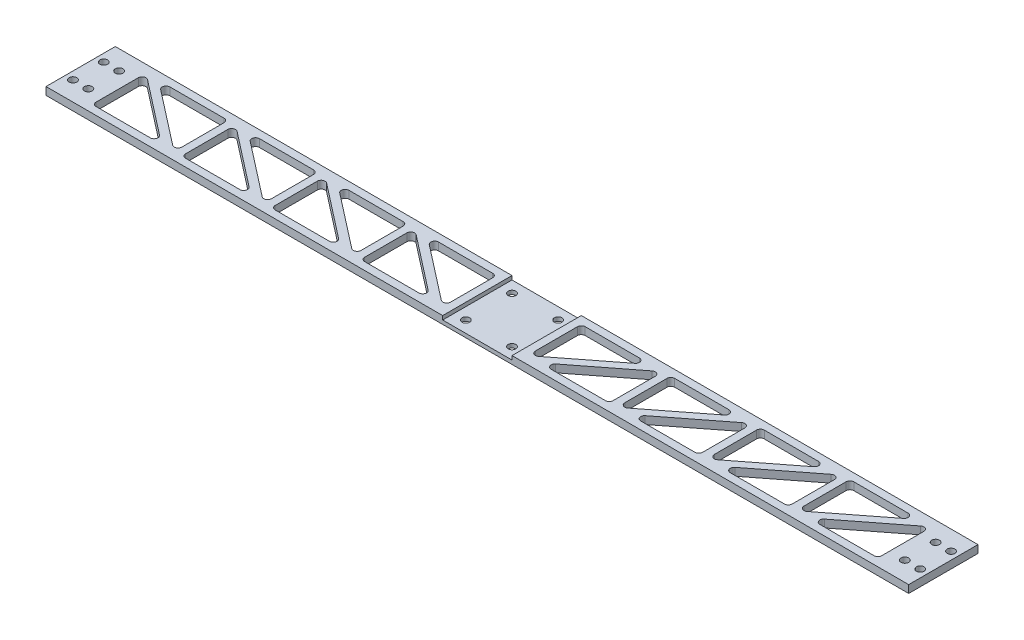
from build123d import *

# Parameters (mm, degrees)
SKETCH2_W                   = 57.15
SKETCH2_H                   = 6.35
BOSS_EXTRUDE2_DEPTH         = 355.6
F_1_4_0_25_DIAMETER_HOLE1_D = 6.35
CUT_EXTRUDE1_REACH          = 358.803
FILLET1_R                   = 3.175
FILLET1_OF_MIRROR1_R        = 3.175
SKETCH7_W                   = 57.15
SKETCH7_H                   = 57.15
CUT_EXTRUDE2_DEPTH          = 3.175
F_1_4_0_25_DIAMETER_HOLE2_D = 6.35


with BuildPart() as part:
    # Sketch2 → Boss-Extrude2 (new, symmetric)
    with BuildSketch(Plane(origin=(0, 0, 0), x_dir=(0, 0, -1), z_dir=(1, 0, 0))):
        Rectangle(SKETCH2_W, SKETCH2_H)
    extrude(amount=BOSS_EXTRUDE2_DEPTH, both=True)

    # 1/4 (0.25) Diameter Hole1 (through all)
    with Locations(Plane(origin=(0, 3.175, 0), x_dir=(1, 0, 0), z_dir=(0, 1, 0))):
        with Locations((-349.25, -12.7), (-349.25, 12.7), (-336.55, 12.7), (-336.55, -12.7)):
            f_1_4_0_25_diameter_hole1 = Hole(F_1_4_0_25_DIAMETER_HOLE1_D / 2)

    # Sketch6 → Cut-Extrude1 (cut, up to next)
    with BuildSketch(Plane(origin=(0, 3.175, 0), x_dir=(1, 0, 0), z_dir=(0, 1, 0)), mode=Mode.PRIVATE) as cut_extrude1_sk1:
        Polygon((-323.85, 22.225), (-323.85, -22.225), (-266.721810637, -22.225), align=None)
    cut_extrude1_tool1 = extrude(cut_extrude1_sk1.sketch, amount=-CUT_EXTRUDE1_REACH, mode=Mode.PRIVATE) & part.part
    # Sketch6 → Cut-Extrude1 (cut, up to next)
    with BuildSketch(Plane(origin=(0, 3.175, 0), x_dir=(1, 0, 0), z_dir=(0, 1, 0)), mode=Mode.PRIVATE) as cut_extrude1_sk2:
        Polygon((-313.509439363, 22.225), (-256.38125, -22.225), (-256.38125, 22.225), align=None)
    cut_extrude1_tool2 = extrude(cut_extrude1_sk2.sketch, amount=-CUT_EXTRUDE1_REACH, mode=Mode.PRIVATE) & part.part
    # Sketch6 → Cut-Extrude1 (cut, up to next)
    with BuildSketch(Plane(origin=(0, 3.175, 0), x_dir=(1, 0, 0), z_dir=(0, 1, 0)), mode=Mode.PRIVATE) as cut_extrude1_sk3:
        Polygon((-250.03125, 22.225), (-250.03125, -22.225), (-192.903060637, -22.225), align=None)
    cut_extrude1_tool3 = extrude(cut_extrude1_sk3.sketch, amount=-CUT_EXTRUDE1_REACH, mode=Mode.PRIVATE) & part.part
    # Sketch6 → Cut-Extrude1 (cut, up to next)
    with BuildSketch(Plane(origin=(0, 3.175, 0), x_dir=(1, 0, 0), z_dir=(0, 1, 0)), mode=Mode.PRIVATE) as cut_extrude1_sk4:
        Polygon((-239.690689363, 22.225), (-182.5625, -22.225), (-182.5625, 22.225), align=None)
    cut_extrude1_tool4 = extrude(cut_extrude1_sk4.sketch, amount=-CUT_EXTRUDE1_REACH, mode=Mode.PRIVATE) & part.part
    # Sketch6 → Cut-Extrude1 (cut, up to next)
    with BuildSketch(Plane(origin=(0, 3.175, 0), x_dir=(1, 0, 0), z_dir=(0, 1, 0)), mode=Mode.PRIVATE) as cut_extrude1_sk5:
        Polygon((-176.2125, 22.225), (-176.2125, -22.225), (-119.084310637, -22.225), align=None)
    cut_extrude1_tool5 = extrude(cut_extrude1_sk5.sketch, amount=-CUT_EXTRUDE1_REACH, mode=Mode.PRIVATE) & part.part
    # Sketch6 → Cut-Extrude1 (cut, up to next)
    with BuildSketch(Plane(origin=(0, 3.175, 0), x_dir=(1, 0, 0), z_dir=(0, 1, 0)), mode=Mode.PRIVATE) as cut_extrude1_sk6:
        Polygon((-165.871939363, 22.225), (-108.74375, -22.225), (-108.74375, 22.225), align=None)
    cut_extrude1_tool6 = extrude(cut_extrude1_sk6.sketch, amount=-CUT_EXTRUDE1_REACH, mode=Mode.PRIVATE) & part.part
    # Sketch6 → Cut-Extrude1 (cut, up to next)
    with BuildSketch(Plane(origin=(0, 3.175, 0), x_dir=(1, 0, 0), z_dir=(0, 1, 0)), mode=Mode.PRIVATE) as cut_extrude1_sk7:
        Polygon((-102.39375, 22.225), (-102.39375, -22.225), (-45.265560637, -22.225), align=None)
    cut_extrude1_tool7 = extrude(cut_extrude1_sk7.sketch, amount=-CUT_EXTRUDE1_REACH, mode=Mode.PRIVATE) & part.part
    # Sketch6 → Cut-Extrude1 (cut, up to next)
    with BuildSketch(Plane(origin=(0, 3.175, 0), x_dir=(1, 0, 0), z_dir=(0, 1, 0)), mode=Mode.PRIVATE) as cut_extrude1_sk8:
        Polygon((-92.053189363, 22.225), (-34.925, -22.225), (-34.925, 22.225), align=None)
    cut_extrude1_tool8 = extrude(cut_extrude1_sk8.sketch, amount=-CUT_EXTRUDE1_REACH, mode=Mode.PRIVATE) & part.part
    cut_extrude1_1 = cut_extrude1_tool1.solids().sort_by_distance((-304.80727, 3.175, 7.408333))[0]
    add(cut_extrude1_1, mode=Mode.SUBTRACT)
    cut_extrude1_2 = cut_extrude1_tool2.solids().sort_by_distance((-275.42398, 3.175, -7.408333))[0]
    add(cut_extrude1_2, mode=Mode.SUBTRACT)
    cut_extrude1_3 = cut_extrude1_tool3.solids().sort_by_distance((-230.98852, 3.175, 7.408333))[0]
    add(cut_extrude1_3, mode=Mode.SUBTRACT)
    cut_extrude1_4 = cut_extrude1_tool4.solids().sort_by_distance((-201.60523, 3.175, -7.408333))[0]
    add(cut_extrude1_4, mode=Mode.SUBTRACT)
    cut_extrude1_5 = cut_extrude1_tool5.solids().sort_by_distance((-157.16977, 3.175, 7.408333))[0]
    add(cut_extrude1_5, mode=Mode.SUBTRACT)
    cut_extrude1_6 = cut_extrude1_tool6.solids().sort_by_distance((-127.78648, 3.175, -7.408333))[0]
    add(cut_extrude1_6, mode=Mode.SUBTRACT)
    cut_extrude1_7 = cut_extrude1_tool7.solids().sort_by_distance((-83.35102, 3.175, 7.408333))[0]
    add(cut_extrude1_7, mode=Mode.SUBTRACT)
    cut_extrude1_8 = cut_extrude1_tool8.solids().sort_by_distance((-53.96773, 3.175, -7.408333))[0]
    add(cut_extrude1_8, mode=Mode.SUBTRACT)
    cut_extrude1 = cut_extrude1_1 + cut_extrude1_2 + cut_extrude1_3 + cut_extrude1_4 + cut_extrude1_5 + cut_extrude1_6 + cut_extrude1_7 + cut_extrude1_8  # Cut-Extrude1 as one shape, for the pattern or mirror that repeats it

    # Fillet1
    fillet1_edges = [part.edges().sort_by_distance(p)[0] for p in [
        (-92.053189363, 0, -22.225),
        (-34.925, 0, -22.225),
        (-34.925, 0, 22.225),
        (-323.85, 0, -22.225),
        (-266.721810637, 0, 22.225),
        (-323.85, 0, 22.225),
        (-313.509439363, 0, -22.225),
        (-256.38125, 0, -22.225),
        (-256.38125, 0, 22.225),
        (-250.03125, 0, -22.225),
        (-192.903060637, 0, 22.225),
        (-250.03125, 0, 22.225),
        (-239.690689363, 0, -22.225),
        (-182.5625, 0, -22.225),
        (-182.5625, 0, 22.225),
        (-176.2125, 0, -22.225),
        (-119.084310637, 0, 22.225),
        (-176.2125, 0, 22.225),
        (-165.871939363, 0, -22.225),
        (-108.74375, 0, -22.225),
        (-108.74375, 0, 22.225),
        (-102.39375, 0, -22.225),
        (-45.265560637, 0, 22.225),
        (-102.39375, 0, 22.225),
    ]]
    fillet(fillet1_edges, radius=FILLET1_R)

    # Mirror1: 1/4 (0.25) Diameter Hole1, Cut-Extrude1 across plane
    add(f_1_4_0_25_diameter_hole1.mirror(Plane(origin=(0, 0, 0), x_dir=(0, 0, 1), z_dir=(1, 0, 0))), mode=Mode.SUBTRACT)
    add(cut_extrude1.mirror(Plane(origin=(0, 0, 0), x_dir=(0, 0, 1), z_dir=(1, 0, 0))), mode=Mode.SUBTRACT)

    # Fillet1 of Mirror1
    fillet1_of_mirror1_edges = [part.edges().sort_by_distance(p)[0] for p in [
        (92.053189363, 0, -22.225),
        (34.925, 0, -22.225),
        (34.925, 0, 22.225),
        (323.85, 0, -22.225),
        (266.721810637, 0, 22.225),
        (323.85, 0, 22.225),
        (313.509439363, 0, -22.225),
        (256.38125, 0, -22.225),
        (256.38125, 0, 22.225),
        (250.03125, 0, -22.225),
        (192.903060637, 0, 22.225),
        (250.03125, 0, 22.225),
        (239.690689363, 0, -22.225),
        (182.5625, 0, -22.225),
        (182.5625, 0, 22.225),
        (176.2125, 0, -22.225),
        (119.084310637, 0, 22.225),
        (176.2125, 0, 22.225),
        (165.871939363, 0, -22.225),
        (108.74375, 0, -22.225),
        (108.74375, 0, 22.225),
        (102.39375, 0, -22.225),
        (45.265560637, 0, 22.225),
        (102.39375, 0, 22.225),
    ]]
    fillet(fillet1_of_mirror1_edges, radius=FILLET1_OF_MIRROR1_R)

    # Sketch7 → Cut-Extrude2 (cut)
    with BuildSketch(Plane(origin=(0, 3.175, 0), x_dir=(1, 0, 0), z_dir=(0, 1, 0))):
        Rectangle(SKETCH7_W, SKETCH7_H)
    extrude(amount=-CUT_EXTRUDE2_DEPTH, mode=Mode.SUBTRACT)

    # 1/4 (0.25) Diameter Hole2 (through all)
    with Locations(Plane(origin=(0, 0, 0), x_dir=(1, 0, 0), z_dir=(0, 1, 0))):
        with Locations((19.05, -19.05), (-19.05, 19.05), (-19.05, -19.05), (19.05, 19.05)):
            Hole(F_1_4_0_25_DIAMETER_HOLE2_D / 2)


solid = part.part
